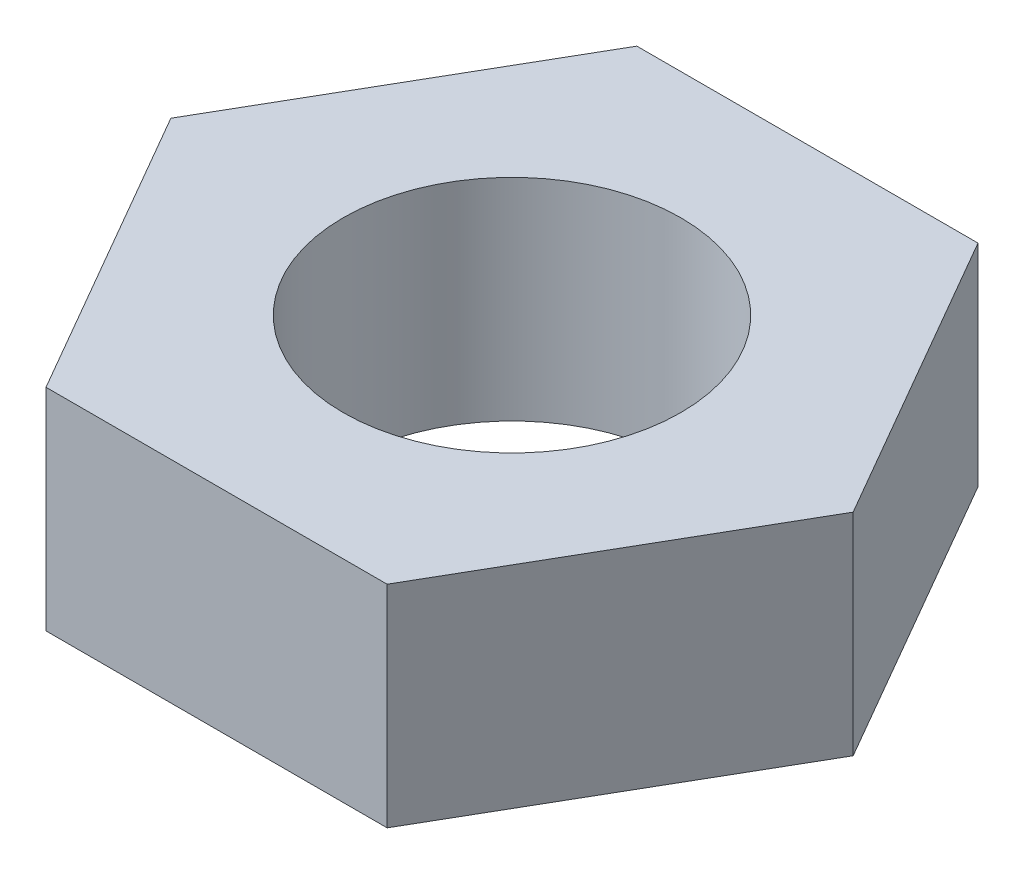
from build123d import *

# Parameters (mm, degrees)
BOSS_EXTRU_1_DEPTH      = 3.96875
ESQUISSE2_R             = 3.175
ENL_V_MAT_EXTRU_1_DEPTH = 10.369388598


with BuildPart() as part:
    # Esquisse1 → Boss.-Extru.1 (new body)
    with BuildSketch(Plane(origin=(0, 0, 0), x_dir=(1, 0, 0), z_dir=(0, 1, 0))):
        Polygon((3.207902433, 5.55625), (-3.207902433, 5.55625), (-6.415804866, 0), (-3.207902433, -5.55625), (3.207902433, -5.55625), (6.415804866, 0), align=None)
    extrude(amount=BOSS_EXTRU_1_DEPTH)

    # Esquisse2 → Enlèv. mat.-Extru.1 (cut, through all)
    with BuildSketch(Plane(origin=(0, 3.96875, 0), x_dir=(1, 0, 0), z_dir=(0, 1, 0))):
        with Locations(Location((0, 0, 0), (0, 0, 270))):
            Circle(ESQUISSE2_R)
    extrude(amount=-ENL_V_MAT_EXTRU_1_DEPTH, mode=Mode.SUBTRACT)


solid = part.part
